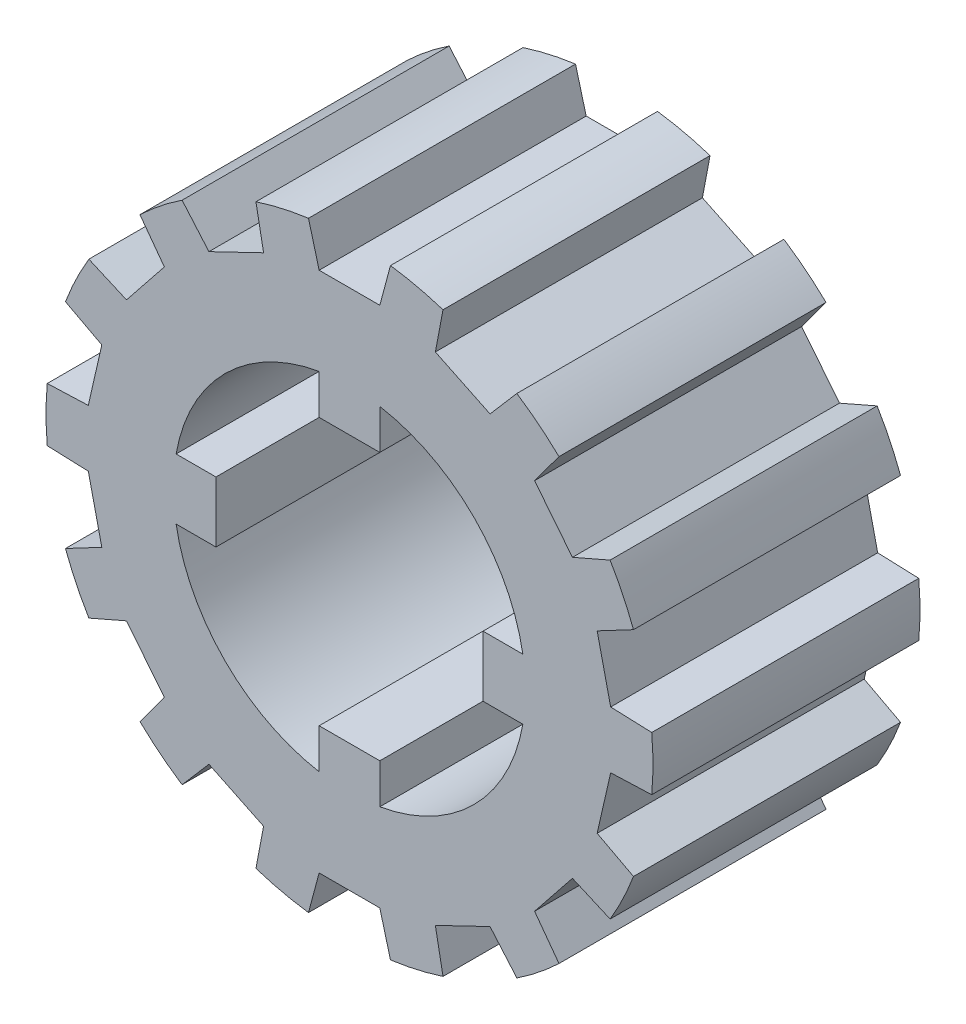
from build123d import *

# Parameters (mm, degrees)
ESBO_O1_R                  = 25
RESSALTO_EXTRUS_O1_DEPTH   = 22
CORTE_EXTRUS_O1_DEPTH      = 24
CORTE_EXTRUS_O1_DEPTH_BACK = 32
CORTE_EXTRUS_O2_DEPTH      = 32
PADR_OCIRCULAR1_COUNT      = 14


with BuildPart() as part:
    # Esboço1 → Ressalto-extrusão1 (new body)
    with BuildSketch(Plane.XY):
        Circle(ESBO_O1_R)
    extrude(amount=RESSALTO_EXTRUS_O1_DEPTH)

    # Esboço2 → Corte-extrusão1 (cut, two sides: drawn at the far end of the back side and taken through both)
    with BuildSketch(Plane.XY.offset(22).offset(-CORTE_EXTRUS_O1_DEPTH_BACK)):
        with BuildLine():
            Line((-2.5, -11), (2.5, -11))
            Line((2.5, -11), (2.5, -14.282856857))
            ThreePointArc((2.5, -14.282856857), (10.253048327, -10.253048327), (14.282856857, -2.5))
            Line((14.282856857, -2.5), (11, -2.5))
            Line((11, -2.5), (11, 2.5))
            Line((11, 2.5), (14.282856857, 2.5))
            ThreePointArc((14.282856857, 2.5), (10.253048327, 10.253048327), (2.5, 14.282856857))
            Line((2.5, 14.282856857), (2.5, 11))
            Line((2.5, 11), (-2.5, 11))
            Line((-2.5, 11), (-2.5, 14.282856857))
            ThreePointArc((-2.5, 14.282856857), (-10.253048327, 10.253048327), (-14.282856857, 2.5))
            Line((-14.282856857, 2.5), (-11, 2.5))
            Line((-11, 2.5), (-11, -2.5))
            Line((-11, -2.5), (-14.282856857, -2.5))
            ThreePointArc((-14.282856857, -2.5), (-10.253048327, -10.253048327), (-2.5, -14.282856857))
            Line((-2.5, -14.282856857), (-2.5, -11))
        make_face()
    extrude(amount=CORTE_EXTRUS_O1_DEPTH + CORTE_EXTRUS_O1_DEPTH_BACK, mode=Mode.SUBTRACT)

    # Esboço3 → Corte-extrusão2 (cut)
    with BuildSketch(Plane.XY.offset(22)):
        Polygon((-3.376446492, -24.770942838), (0.890947549, -26.390974492), (3.376446492, -24.770942838), (2.5, -21.5), (-2.5, -21.5), align=None)
    corte_extrus_o2 = extrude(amount=-CORTE_EXTRUS_O2_DEPTH, mode=Mode.SUBTRACT)

    # PadrãoCircular1: Corte-extrusão2 ×14 about axis
    padr_ocircular1_axis = Axis((0, 0, 0), (0, 0, 1))
    for i in range(1, PADR_OCIRCULAR1_COUNT):
        add(corte_extrus_o2.rotate(padr_ocircular1_axis, i * 360 / PADR_OCIRCULAR1_COUNT), mode=Mode.SUBTRACT)


solid = part.part
